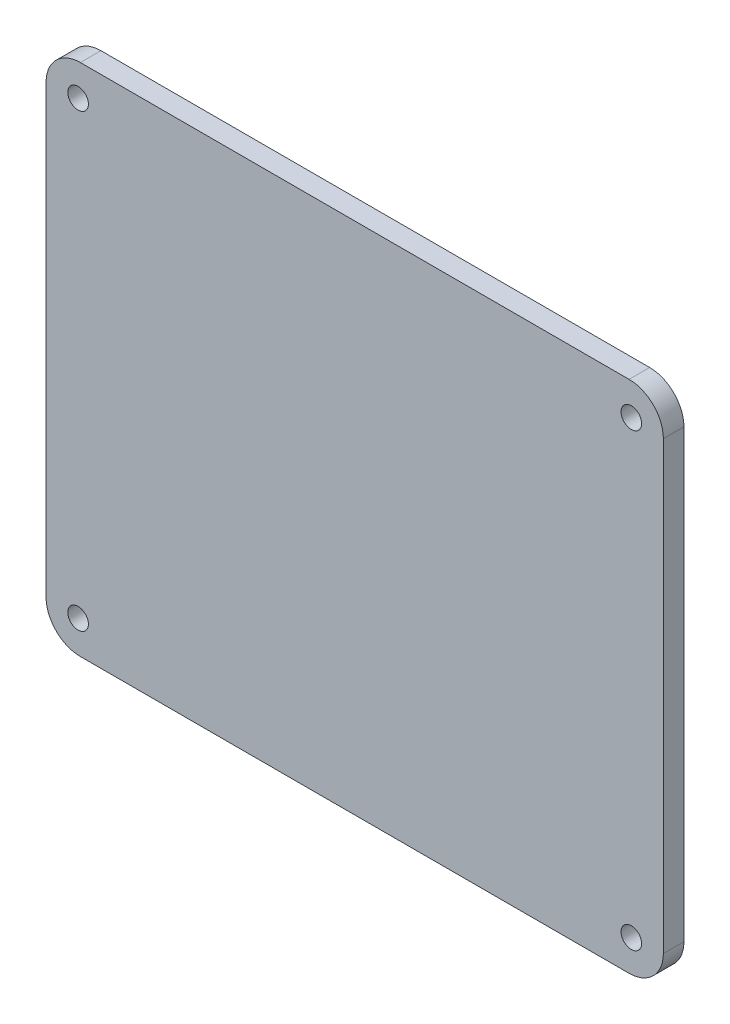
from build123d import *

# Parameters (mm, degrees)
EXTRUDE_1_DEPTH     = 3
SKETCH_2_R          = 1.5
CUT_EXTRUDE_1_DEPTH = 10


with BuildPart() as part:
    # 草图1 → 凸台-拉伸1 (new body)
    with BuildSketch(Plane.XY):
        with BuildLine():
            Line((-40, 37.5), (40, 37.5))
            ThreePointArc((40, 37.5), (43.535533906, 36.035533906), (45, 32.5))
            Line((45, 32.5), (45, -32.5))
            ThreePointArc((45, -32.5), (43.535533906, -36.035533906), (40, -37.5))
            Line((40, -37.5), (-40, -37.5))
            ThreePointArc((-40, -37.5), (-43.535533906, -36.035533906), (-45, -32.5))
            Line((-45, -32.5), (-45, 32.5))
            ThreePointArc((-45, 32.5), (-43.535533906, 36.035533906), (-40, 37.5))
        make_face()
    extrude(amount=EXTRUDE_1_DEPTH)

    # 草图2 → 切除-拉伸1 (cut)
    with BuildSketch(Plane.XY.offset(3)):
        with Locations((40.328427125, 32.828427125)):
            Circle(SKETCH_2_R)
        with Locations((-40.328427125, 32.828427125)):
            Circle(SKETCH_2_R)
        with Locations((-40.328427125, -32.828427125)):
            Circle(SKETCH_2_R)
        with Locations((40.328427125, -32.828427125)):
            Circle(SKETCH_2_R)
    extrude(amount=-CUT_EXTRUDE_1_DEPTH, mode=Mode.SUBTRACT)


solid = part.part
